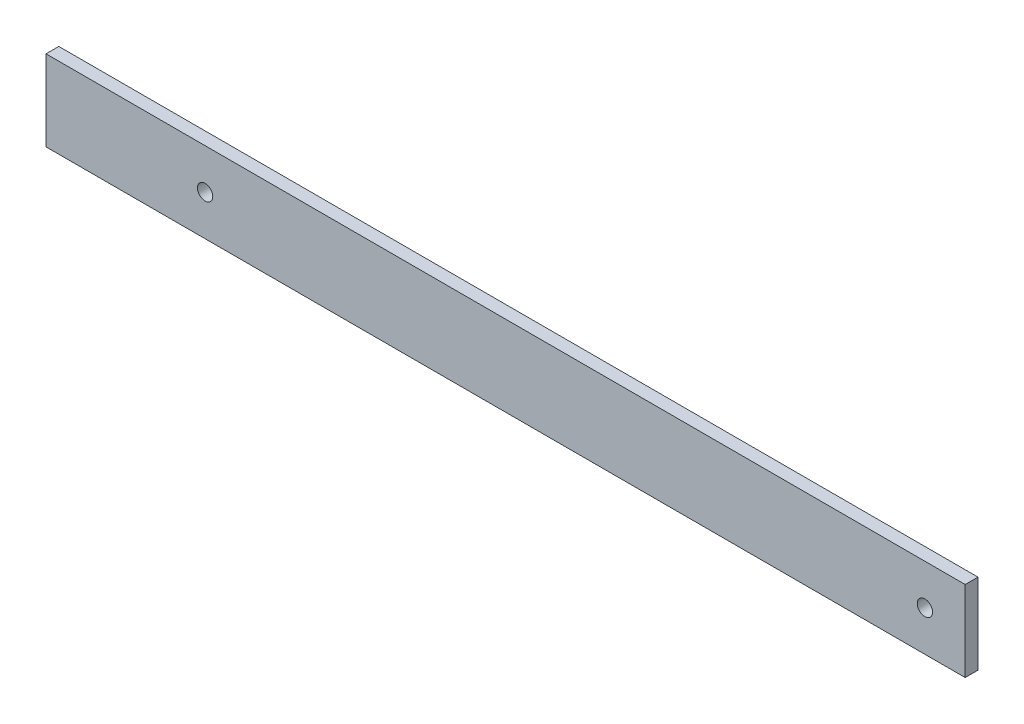
from build123d import *

# Parameters (mm, degrees)
SKETCH2_W             = 228.06
SKETCH2_H             = 20
BOSS_EXTRUDE1_DEPTH   = 3.175
F_6_CLEARANCE_HOLE1_D = 3.7973


with BuildPart() as part:
    # Sketch2 → Boss-Extrude1 (new body)
    with BuildSketch(Plane.XY):
        with Locations((114.03, 10)):
            Rectangle(SKETCH2_W, SKETCH2_H)
    extrude(amount=-BOSS_EXTRUDE1_DEPTH)

    # #6 Clearance Hole1 (through all)
    with Locations(Plane.XY):
        with Locations((218.06, 10), (39.475, 10)):
            Hole(F_6_CLEARANCE_HOLE1_D / 2)


solid = part.part
